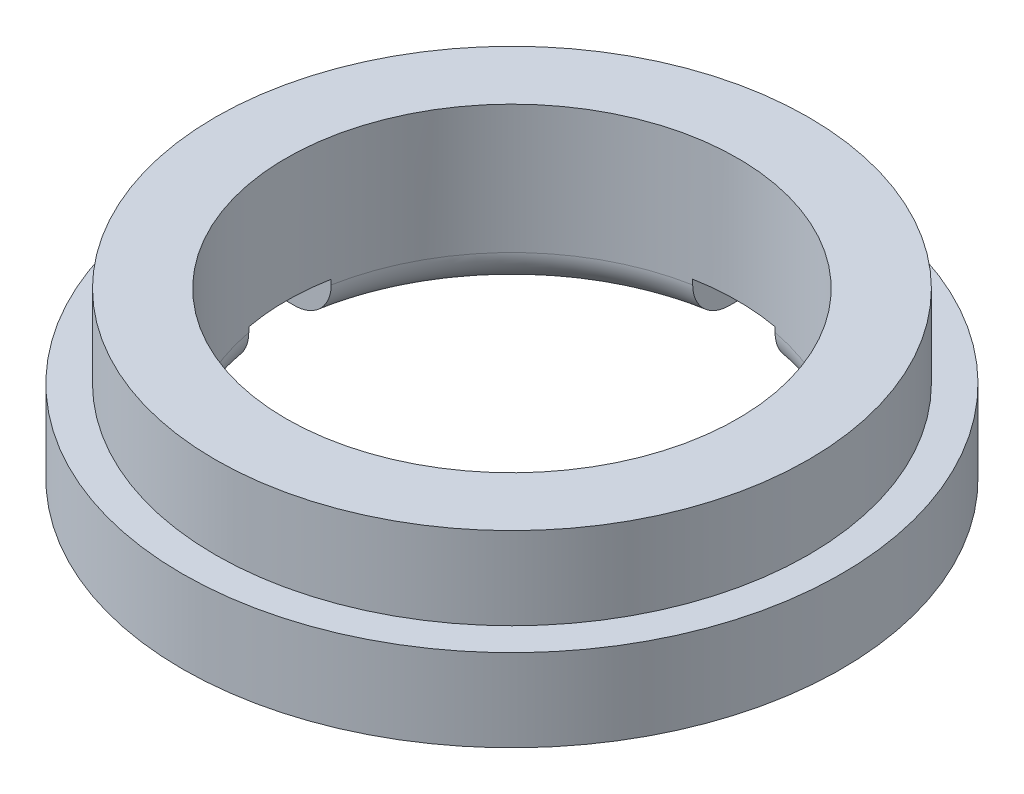
from build123d import *

# Parameters (mm, degrees)
SKETCH1_R           = 50.8
SKETCH1_R_2         = 34.798
BOSS_EXTRUDE1_DEPTH = 12.7
SKETCH2_R           = 45.72
SKETCH2_R_2         = 34.798
BOSS_EXTRUDE2_DEPTH = 12.7
FILLET1_R           = 5.588
SKETCH3_W           = 12.7
SKETCH3_H           = 12.7
CUT_EXTRUDE1_DEPTH  = 6.35
CIRPATTERN1_COUNT   = 4


with BuildPart() as part:
    # Sketch1 → Boss-Extrude1 (new body)
    with BuildSketch(Plane(origin=(0, 0, 0), x_dir=(1, 0, 0), z_dir=(0, 1, 0))):
        with Locations(Location((0, 0, 0), (0, 0, 270))):
            Circle(SKETCH1_R)
        with Locations(Location((0, 0, 0), (0, 0, 270))):
            Circle(SKETCH1_R_2, mode=Mode.SUBTRACT)
    extrude(amount=BOSS_EXTRUDE1_DEPTH)

    # Sketch2 → Boss-Extrude2 (add)
    with BuildSketch(Plane(origin=(0, 12.7, 0), x_dir=(1, 0, 0), z_dir=(0, 1, 0))):
        with Locations(Location((0, 0, 0), (0, 0, 270))):
            Circle(SKETCH2_R)
        with Locations(Location((0, 0, 0), (0, 0, 270))):
            Circle(SKETCH2_R_2, mode=Mode.SUBTRACT)
    extrude(amount=BOSS_EXTRUDE2_DEPTH)

    # Fillet1
    fillet1_edges = [part.edges().sort_by_distance(p)[0] for p in [
        (0, 0, -34.798),
    ]]
    fillet(fillet1_edges, radius=FILLET1_R)

    # Sketch3 → Cut-Extrude1 (cut)
    with BuildSketch(Plane.XZ):
        with Locations((34.925, 0)):
            Rectangle(SKETCH3_W, SKETCH3_H)
    cut_extrude1 = extrude(amount=-CUT_EXTRUDE1_DEPTH, mode=Mode.SUBTRACT)

    # CirPattern1: Cut-Extrude1 ×4 about axis
    cirpattern1_axis = Axis((0, 0, 0), (0, 1, 0))
    for i in range(1, CIRPATTERN1_COUNT):
        add(cut_extrude1.rotate(cirpattern1_axis, i * 360 / CIRPATTERN1_COUNT), mode=Mode.SUBTRACT)


solid = part.part
